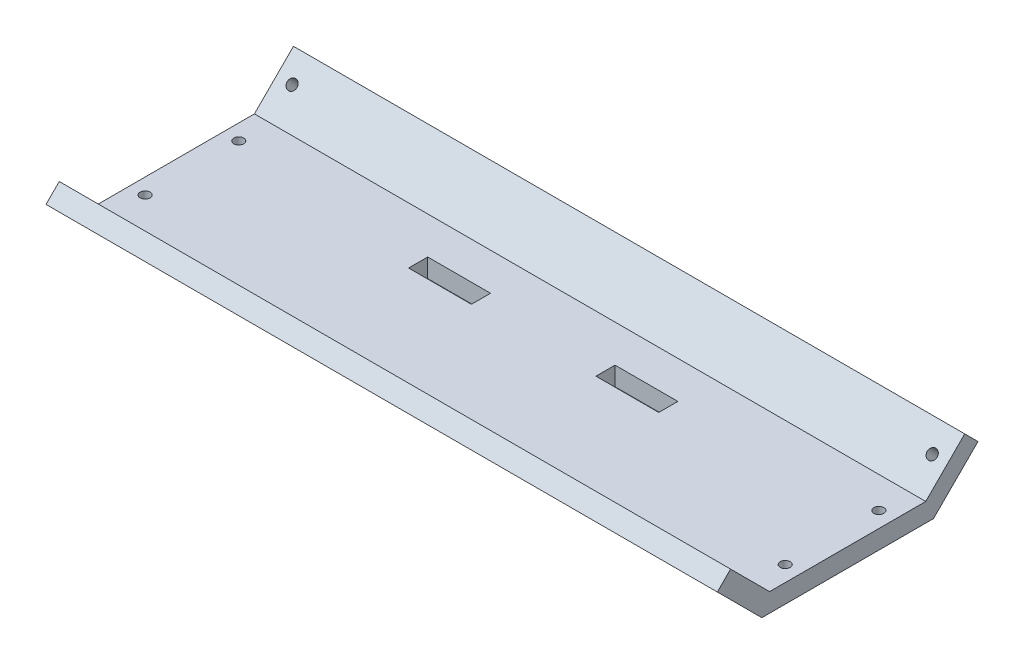
from build123d import *

# Parameters (mm, degrees)
MAIN_DEPTH                      = 107.5
F_4_0MM_DOWEL_HOLE2_D           = 3.2
F_4_0MM_DOWEL_HOLE2_ON_FACE_2_D = 3.2
F_4_0MM_DOWEL_HOLE2_ON_FACE_3_D = 3.2
F_4_0MM_DOWEL_HOLE2_ON_FACE_4_D = 3.2
SKETCH6_W                       = 20.125
SKETCH6_H                       = 6.125
SHELF_CUT_DEPTH                 = 116.995465651


with BuildPart() as part:
    # Sketch2 → Main (new, symmetric)
    with BuildSketch(Plane(origin=(0, 0, 0), x_dir=(0, 0, -1), z_dir=(1, 0, 0))):
        Polygon((-25, 0), (25, 0), (37.5, 12.5), (41.742640687, 8.257359313), (27.485281374, -6), (-27.485281374, -6), (-41.742640687, 8.257359313), (-37.5, 12.5), align=None)
    extrude(amount=MAIN_DEPTH, both=True)

    # Ø4.0mm Dowel Hole2 (through all)
    with Locations(Plane(origin=(-102.5, 7.071067812, -32.071067812), x_dir=(0, 0.707106781187, -0.707106781187), z_dir=(0, 0.707106781187, 0.707106781187))):
        with Locations((0, 0)):
            Hole(F_4_0MM_DOWEL_HOLE2_D / 2)

    # Ø4.0mm Dowel Hole2 on face 2 (through all)
    with Locations(Plane(origin=(-102.5, 0, -15), x_dir=(0, 0, 1), z_dir=(0, 1, 0))):
        with Locations((0, 0), (30, 0), (30, 205), (0, 205)):
            Hole(F_4_0MM_DOWEL_HOLE2_ON_FACE_2_D / 2)

    # Ø4.0mm Dowel Hole2 on face 3 (through all)
    with Locations(Plane(origin=(-102.5, 7.071067812, 32.071067812), x_dir=(0, -0.707106781187, -0.707106781187), z_dir=(0, 0.707106781187, -0.707106781187))):
        with Locations((0, 0), (0, -205)):
            Hole(F_4_0MM_DOWEL_HOLE2_ON_FACE_3_D / 2)

    # Ø4.0mm Dowel Hole2 on face 4 (through all)
    with Locations(Plane(origin=(102.5, 7.071067812, -32.071067812), x_dir=(0, 0.707106781187, -0.707106781187), z_dir=(0, 0.707106781187, 0.707106781187))):
        with Locations((0, 0)):
            Hole(F_4_0MM_DOWEL_HOLE2_ON_FACE_4_D / 2)

    # Sketch6 → Shelf cut (cut, through all)
    with BuildSketch(Plane(origin=(0, 0, 0), x_dir=(1, 0, 0), z_dir=(0, 1, 0))):
        with Locations((30, 10)):
            Rectangle(SKETCH6_W, SKETCH6_H)
        with Locations((-30, 10)):
            Rectangle(SKETCH6_W, SKETCH6_H)
    extrude(amount=-SHELF_CUT_DEPTH, mode=Mode.SUBTRACT)


solid = part.part
